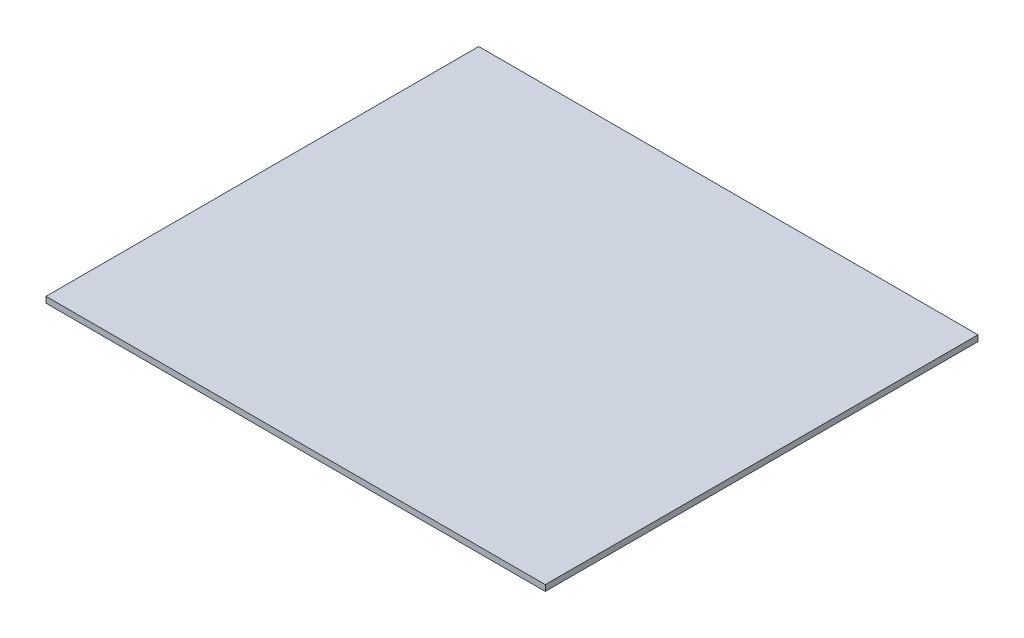
from build123d import *

# Parameters (mm, degrees)
EXTRUDE_1_DEPTH = 182


with BuildPart() as part:
    # 草图1 → 凸台-拉伸1 (new body)
    with BuildSketch(Plane.XY):
        Polygon((-105, 20.5), (-100, 20.5), (100, 20.5), (105, 20.5), (105, 23), (-105, 23), align=None)
    extrude(amount=EXTRUDE_1_DEPTH)


solid = part.part
